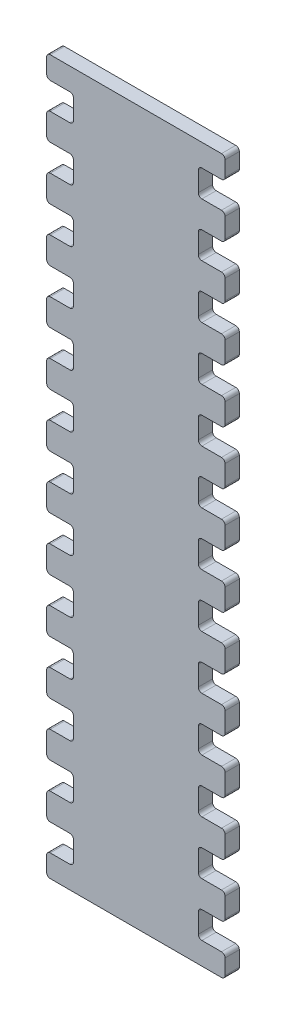
from build123d import *

# Parameters (mm, degrees)
SKETCH1_W                = 200
SKETCH1_H                = 800
BOSS_EXTRUDE1_DEPTH      = 16
SKETCH2_W                = 30
SKETCH2_H                = 30
CUT_EXTRUDE8_DEPTH       = 807.384523661
LPATTERN1_COUNT          = 13
LPATTERN1_PITCH          = 60
MIRROR2_COPY_1_SKETCH_W  = 30
MIRROR2_COPY_1_SKETCH_H  = 30
MIRROR2_COPY_1_DEPTH     = 807.384523661
MIRROR2_COPY_2_SKETCH_W  = 30
MIRROR2_COPY_2_SKETCH_H  = 30
MIRROR2_COPY_2_DEPTH     = 807.384523661
MIRROR2_COPY_3_SKETCH_W  = 30
MIRROR2_COPY_3_SKETCH_H  = 30
MIRROR2_COPY_3_DEPTH     = 807.384523661
MIRROR2_COPY_4_SKETCH_W  = 30
MIRROR2_COPY_4_SKETCH_H  = 30
MIRROR2_COPY_4_DEPTH     = 807.384523661
MIRROR2_COPY_5_SKETCH_W  = 30
MIRROR2_COPY_5_SKETCH_H  = 30
MIRROR2_COPY_5_DEPTH     = 807.384523661
MIRROR2_COPY_6_SKETCH_W  = 30
MIRROR2_COPY_6_SKETCH_H  = 30
MIRROR2_COPY_6_DEPTH     = 807.384523661
MIRROR2_COPY_7_SKETCH_W  = 30
MIRROR2_COPY_7_SKETCH_H  = 30
MIRROR2_COPY_7_DEPTH     = 807.384523661
MIRROR2_COPY_8_SKETCH_W  = 30
MIRROR2_COPY_8_SKETCH_H  = 30
MIRROR2_COPY_8_DEPTH     = 807.384523661
MIRROR2_COPY_9_SKETCH_W  = 30
MIRROR2_COPY_9_SKETCH_H  = 30
MIRROR2_COPY_9_DEPTH     = 807.384523661
MIRROR2_COPY_10_SKETCH_W = 30
MIRROR2_COPY_10_SKETCH_H = 30
MIRROR2_COPY_10_DEPTH    = 807.384523661
MIRROR2_COPY_11_SKETCH_W = 30
MIRROR2_COPY_11_SKETCH_H = 30
MIRROR2_COPY_11_DEPTH    = 807.384523661
MIRROR2_COPY_12_SKETCH_W = 30
MIRROR2_COPY_12_SKETCH_H = 30
MIRROR2_COPY_12_DEPTH    = 807.384523661
MIRROR2_COPY_13_SKETCH_W = 30
MIRROR2_COPY_13_SKETCH_H = 30
MIRROR2_COPY_13_DEPTH    = 807.384523661
FILLET2_R                = 4


with BuildPart() as part:
    # Sketch1 → Boss-Extrude1 (new body)
    with BuildSketch(Plane.XY):
        with Locations((0, 400)):
            Rectangle(SKETCH1_W, SKETCH1_H)
    extrude(amount=BOSS_EXTRUDE1_DEPTH)

    # Sketch2 → Cut-Extrude8 (cut, symmetric)
    with BuildSketch(Plane.XY.offset(16)):
        with Locations((85, 40)):
            Rectangle(SKETCH2_W, SKETCH2_H)
    cut_extrude8 = extrude(amount=CUT_EXTRUDE8_DEPTH, both=True, mode=Mode.SUBTRACT)

    # LPattern1: Cut-Extrude8 ×13
    with Locations(*[(0, i * LPATTERN1_PITCH, 0) for i in range(1, LPATTERN1_COUNT)]):
        add(cut_extrude8, mode=Mode.SUBTRACT)

    # Mirror1: Cut-Extrude8 across plane
    add(cut_extrude8.mirror(Plane(origin=(0, 0, 0), x_dir=(0, 0, 1), z_dir=(1, 0, 0))), mode=Mode.SUBTRACT)

    # Mirror2 copy 1 sketch → Mirror2 copy 1 (cut, symmetric)
    with BuildSketch(Plane(origin=(0, 60, 16), x_dir=(-1, 0, 0), z_dir=(0, 0, 1))):
        with Locations((85, -40)):
            Rectangle(MIRROR2_COPY_1_SKETCH_W, MIRROR2_COPY_1_SKETCH_H)
    extrude(amount=MIRROR2_COPY_1_DEPTH, both=True, mode=Mode.SUBTRACT)

    # Mirror2 copy 2 sketch → Mirror2 copy 2 (cut, symmetric)
    with BuildSketch(Plane(origin=(0, 120, 16), x_dir=(-1, 0, 0), z_dir=(0, 0, 1))):
        with Locations((85, -40)):
            Rectangle(MIRROR2_COPY_2_SKETCH_W, MIRROR2_COPY_2_SKETCH_H)
    extrude(amount=MIRROR2_COPY_2_DEPTH, both=True, mode=Mode.SUBTRACT)

    # Mirror2 copy 3 sketch → Mirror2 copy 3 (cut, symmetric)
    with BuildSketch(Plane(origin=(0, 180, 16), x_dir=(-1, 0, 0), z_dir=(0, 0, 1))):
        with Locations((85, -40)):
            Rectangle(MIRROR2_COPY_3_SKETCH_W, MIRROR2_COPY_3_SKETCH_H)
    extrude(amount=MIRROR2_COPY_3_DEPTH, both=True, mode=Mode.SUBTRACT)

    # Mirror2 copy 4 sketch → Mirror2 copy 4 (cut, symmetric)
    with BuildSketch(Plane(origin=(0, 240, 16), x_dir=(-1, 0, 0), z_dir=(0, 0, 1))):
        with Locations((85, -40)):
            Rectangle(MIRROR2_COPY_4_SKETCH_W, MIRROR2_COPY_4_SKETCH_H)
    extrude(amount=MIRROR2_COPY_4_DEPTH, both=True, mode=Mode.SUBTRACT)

    # Mirror2 copy 5 sketch → Mirror2 copy 5 (cut, symmetric)
    with BuildSketch(Plane(origin=(0, 300, 16), x_dir=(-1, 0, 0), z_dir=(0, 0, 1))):
        with Locations((85, -40)):
            Rectangle(MIRROR2_COPY_5_SKETCH_W, MIRROR2_COPY_5_SKETCH_H)
    extrude(amount=MIRROR2_COPY_5_DEPTH, both=True, mode=Mode.SUBTRACT)

    # Mirror2 copy 6 sketch → Mirror2 copy 6 (cut, symmetric)
    with BuildSketch(Plane(origin=(0, 360, 16), x_dir=(-1, 0, 0), z_dir=(0, 0, 1))):
        with Locations((85, -40)):
            Rectangle(MIRROR2_COPY_6_SKETCH_W, MIRROR2_COPY_6_SKETCH_H)
    extrude(amount=MIRROR2_COPY_6_DEPTH, both=True, mode=Mode.SUBTRACT)

    # Mirror2 copy 7 sketch → Mirror2 copy 7 (cut, symmetric)
    with BuildSketch(Plane(origin=(0, 420, 16), x_dir=(-1, 0, 0), z_dir=(0, 0, 1))):
        with Locations((85, -40)):
            Rectangle(MIRROR2_COPY_7_SKETCH_W, MIRROR2_COPY_7_SKETCH_H)
    extrude(amount=MIRROR2_COPY_7_DEPTH, both=True, mode=Mode.SUBTRACT)

    # Mirror2 copy 8 sketch → Mirror2 copy 8 (cut, symmetric)
    with BuildSketch(Plane(origin=(0, 480, 16), x_dir=(-1, 0, 0), z_dir=(0, 0, 1))):
        with Locations((85, -40)):
            Rectangle(MIRROR2_COPY_8_SKETCH_W, MIRROR2_COPY_8_SKETCH_H)
    extrude(amount=MIRROR2_COPY_8_DEPTH, both=True, mode=Mode.SUBTRACT)

    # Mirror2 copy 9 sketch → Mirror2 copy 9 (cut, symmetric)
    with BuildSketch(Plane(origin=(0, 540, 16), x_dir=(-1, 0, 0), z_dir=(0, 0, 1))):
        with Locations((85, -40)):
            Rectangle(MIRROR2_COPY_9_SKETCH_W, MIRROR2_COPY_9_SKETCH_H)
    extrude(amount=MIRROR2_COPY_9_DEPTH, both=True, mode=Mode.SUBTRACT)

    # Mirror2 copy 10 sketch → Mirror2 copy 10 (cut, symmetric)
    with BuildSketch(Plane(origin=(0, 600, 16), x_dir=(-1, 0, 0), z_dir=(0, 0, 1))):
        with Locations((85, -40)):
            Rectangle(MIRROR2_COPY_10_SKETCH_W, MIRROR2_COPY_10_SKETCH_H)
    extrude(amount=MIRROR2_COPY_10_DEPTH, both=True, mode=Mode.SUBTRACT)

    # Mirror2 copy 11 sketch → Mirror2 copy 11 (cut, symmetric)
    with BuildSketch(Plane(origin=(0, 660, 16), x_dir=(-1, 0, 0), z_dir=(0, 0, 1))):
        with Locations((85, -40)):
            Rectangle(MIRROR2_COPY_11_SKETCH_W, MIRROR2_COPY_11_SKETCH_H)
    extrude(amount=MIRROR2_COPY_11_DEPTH, both=True, mode=Mode.SUBTRACT)

    # Mirror2 copy 12 sketch → Mirror2 copy 12 (cut, symmetric)
    with BuildSketch(Plane(origin=(0, 720, 16), x_dir=(-1, 0, 0), z_dir=(0, 0, 1))):
        with Locations((85, -40)):
            Rectangle(MIRROR2_COPY_12_SKETCH_W, MIRROR2_COPY_12_SKETCH_H)
    extrude(amount=MIRROR2_COPY_12_DEPTH, both=True, mode=Mode.SUBTRACT)

    # Mirror2 copy 13 sketch → Mirror2 copy 13 (cut, symmetric)
    with BuildSketch(Plane(origin=(0, 0, 16), x_dir=(-1, 0, 0), z_dir=(0, 0, 1))):
        with Locations((85, -40)):
            Rectangle(MIRROR2_COPY_13_SKETCH_W, MIRROR2_COPY_13_SKETCH_H)
    extrude(amount=MIRROR2_COPY_13_DEPTH, both=True, mode=Mode.SUBTRACT)

    # Fillet2
    fillet2_edges = [part.edges().sort_by_distance(p)[0] for p in [
        (70, 175, 8),
        (100, 175, 8),
        (100, 145, 8),
        (70, 145, 8),
        (70, 235, 8),
        (100, 235, 8),
        (100, 205, 8),
        (70, 205, 8),
        (70, 295, 8),
        (100, 295, 8),
        (100, 265, 8),
        (70, 265, 8),
        (70, 355, 8),
        (100, 355, 8),
        (100, 325, 8),
        (70, 325, 8),
        (70, 415, 8),
        (100, 415, 8),
        (100, 385, 8),
        (70, 385, 8),
        (70, 475, 8),
        (100, 475, 8),
        (100, 445, 8),
        (70, 445, 8),
        (70, 535, 8),
        (100, 535, 8),
        (100, 505, 8),
        (70, 505, 8),
        (70, 595, 8),
        (100, 595, 8),
        (100, 565, 8),
        (70, 565, 8),
        (70, 655, 8),
        (100, 655, 8),
        (100, 625, 8),
        (70, 625, 8),
        (70, 715, 8),
        (100, 715, 8),
        (100, 685, 8),
        (70, 685, 8),
        (70, 775, 8),
        (100, 775, 8),
        (100, 745, 8),
        (70, 745, 8),
        (70, 55, 8),
        (100, 55, 8),
        (100, 25, 8),
        (70, 25, 8),
        (-70, 55, 8),
        (-100, 25, 8),
        (-100, 55, 8),
        (-70, 25, 8),
        (-100, 115, 8),
        (-70, 115, 8),
        (-70, 85, 8),
        (-100, 85, 8),
        (-100, 175, 8),
        (-70, 175, 8),
        (-70, 145, 8),
        (-100, 145, 8),
        (-100, 235, 8),
        (-70, 235, 8),
        (-70, 205, 8),
        (-100, 205, 8),
        (-100, 295, 8),
        (-70, 295, 8),
        (-70, 265, 8),
        (-100, 265, 8),
        (-100, 355, 8),
        (-70, 355, 8),
        (-70, 325, 8),
        (-100, 325, 8),
        (-100, 415, 8),
        (-70, 415, 8),
        (-70, 385, 8),
        (-100, 385, 8),
        (-100, 475, 8),
        (-70, 475, 8),
        (-70, 445, 8),
        (-100, 445, 8),
        (-100, 535, 8),
        (-70, 535, 8),
        (-70, 505, 8),
        (-100, 505, 8),
        (-100, 595, 8),
        (-70, 595, 8),
        (-70, 565, 8),
        (-100, 565, 8),
        (-100, 655, 8),
        (-70, 655, 8),
        (-70, 625, 8),
        (-100, 625, 8),
        (-100, 715, 8),
        (-70, 715, 8),
        (-70, 685, 8),
        (-100, 685, 8),
        (-100, 775, 8),
        (-70, 775, 8),
        (-70, 745, 8),
        (-100, 745, 8),
        (-100, 800, 8),
        (100, 800, 8),
        (100, 0, 8),
        (-100, 0, 8),
        (70, 115, 8),
        (100, 115, 8),
        (100, 85, 8),
        (70, 85, 8),
    ]]
    fillet(fillet2_edges, radius=FILLET2_R)


solid = part.part
